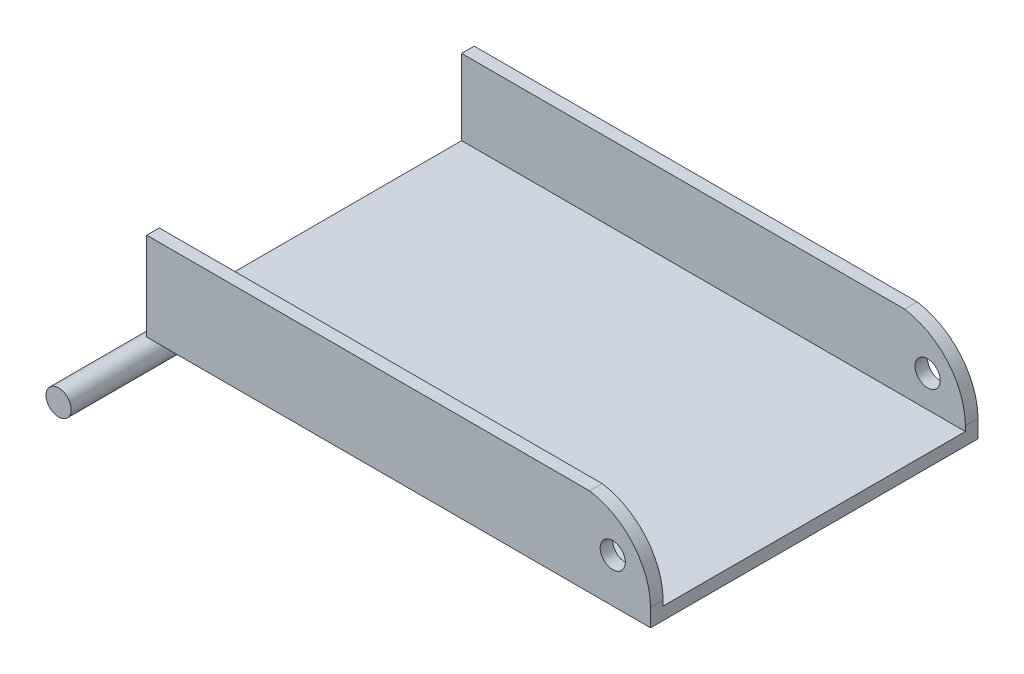
from build123d import *

# Parameters (mm, degrees)
SKETCH1_R           = 5
BOSS_EXTRUDE1_DEPTH = 200
SKETCH2_W           = 130
SKETCH2_H           = 5
BOSS_EXTRUDE2_DEPTH = 200
SKETCH3_W           = 200
SKETCH3_H           = 5
BOSS_EXTRUDE3_DEPTH = 30
SKETCH4_R           = 5
CUT_EXTRUDE1_DEPTH  = 263.345192447
CUT_EXTRUDE2_DEPTH  = 263.345192447


with BuildPart() as part:
    # Sketch1 → Boss-Extrude1 (new body)
    with BuildSketch(Plane.XY):
        Circle(SKETCH1_R)
    extrude(amount=BOSS_EXTRUDE1_DEPTH)


with BuildPart() as body_2:
    # Sketch2 → Boss-Extrude2 (new body)
    with BuildSketch(Plane(origin=(0, 0, 0), x_dir=(0, 0, -1), z_dir=(1, 0, 0))):
        with Locations((-100, 7.5)):
            Rectangle(SKETCH2_W, SKETCH2_H)
    extrude(amount=BOSS_EXTRUDE2_DEPTH)

    # Sketch3 → Boss-Extrude3 (add)
    with BuildSketch(Plane(origin=(0, 10, 0), x_dir=(1, 0, 0), z_dir=(0, 1, 0))):
        with Locations((100, -37.5)):
            Rectangle(SKETCH3_W, SKETCH3_H)
        with Locations((100, -162.5)):
            Rectangle(SKETCH3_W, SKETCH3_H)
    extrude(amount=BOSS_EXTRUDE3_DEPTH)

    # Sketch4 → Cut-Extrude1 (cut, through all)
    with BuildSketch(Plane.XY.offset(165)):
        with Locations((185, 22.5)):
            Circle(SKETCH4_R)
    extrude(amount=-CUT_EXTRUDE1_DEPTH, mode=Mode.SUBTRACT)

    # Sketch5 → Cut-Extrude2 (cut, through all)
    with BuildSketch(Plane.XY.offset(165)):
        with BuildLine():
            Line((175.8328498, 40), (193.165721177, 65.010867295))
            Line((193.165721177, 65.010867295), (236.634308573, 44.851522415))
            Line((236.634308573, 44.851522415), (213.857727293, 11.985528119))
            Line((213.857727293, 11.985528119), (200, 11.985528119))
            ThreePointArc((200, 11.985528119), (193.055131936, 30.425755169), (175.8328498, 40))
        make_face()
    extrude(amount=-CUT_EXTRUDE2_DEPTH, mode=Mode.SUBTRACT)


solid = Compound([part.part, body_2.part])
